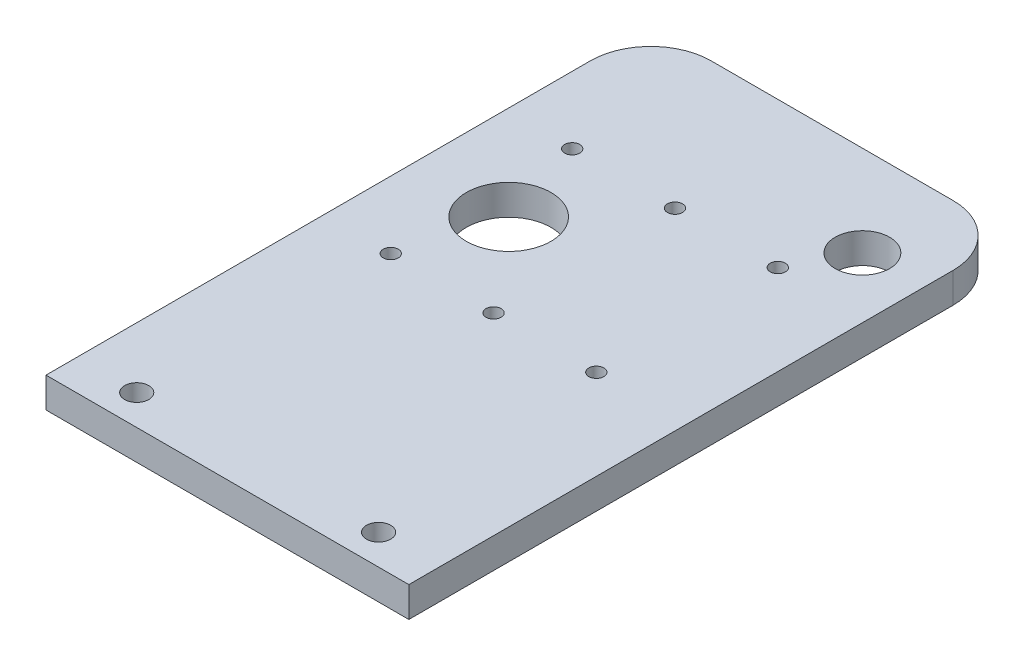
from build123d import *

# Parameters (mm, degrees)
SKETCH_1_R      = 7
SKETCH_1_R_2    = 2
SKETCH_1_R_3    = 4.5
SKETCH_1_R_4    = 1.25
EXTRUDE_1_DEPTH = 5


with BuildPart() as part:
    # 草图1 → 凸台-拉伸1 (new body)
    with BuildSketch(Plane(origin=(0, 0, 0), x_dir=(1, 0, 0), z_dir=(0, 1, 0))):
        with BuildLine():
            Line((-65.328738569, 31.45065883), (-65.328738569, -58.54934117))
            Line((-65.328738569, -58.54934117), (-55.328738569, -58.54934117))
            Line((-55.328738569, -58.54934117), (-15.328738569, -58.54934117))
            Line((-15.328738569, -58.54934117), (-5.328738569, -58.54934117))
            Line((-5.328738569, -58.54934117), (-5.328738569, 2.36065883))
            Line((-5.328738569, 2.36065883), (-5.328738569, 31.45065883))
            ThreePointArc((-5.328738569, 31.45065883), (-8.257670757, 38.521726641), (-15.328738569, 41.45065883))
            Line((-15.328738569, 41.45065883), (-55.328738569, 41.45065883))
            ThreePointArc((-55.328738569, 41.45065883), (-62.399806381, 38.521726641), (-65.328738569, 31.45065883))
        make_face()
        with Locations(Location((-49.728738569, 2.36065883, 0), (0, 0, 270))):
            Circle(SKETCH_1_R, mode=Mode.SUBTRACT)
        with Locations(Location((-55.328738569, -53.54934117, 0), (0, 0, 270))):
            Circle(SKETCH_1_R_2, mode=Mode.SUBTRACT)
        with Locations(Location((-15.328738569, -53.54934117, 0), (0, 0, 270))):
            Circle(SKETCH_1_R_2, mode=Mode.SUBTRACT)
        with Locations(Location((-15.328738569, 26.45065883, 0), (0, 0, 270))):
            Circle(SKETCH_1_R_3, mode=Mode.SUBTRACT)
        with Locations(Location((-54.228738569, 17.36065883, 0), (0, 0, 270))):
            Circle(SKETCH_1_R_4, mode=Mode.SUBTRACT)
        with Locations(Location((-37.228738569, 17.36065883, 0), (0, 0, 270))):
            Circle(SKETCH_1_R_4, mode=Mode.SUBTRACT)
        with Locations(Location((-20.228738569, 17.36065883, 0), (0, 0, 270))):
            Circle(SKETCH_1_R_4, mode=Mode.SUBTRACT)
        with Locations(Location((-54.228738569, -12.63934117, 0), (0, 0, 270))):
            Circle(SKETCH_1_R_4, mode=Mode.SUBTRACT)
        with Locations(Location((-37.228738569, -12.63934117, 0), (0, 0, 270))):
            Circle(SKETCH_1_R_4, mode=Mode.SUBTRACT)
        with Locations(Location((-20.228738569, -12.63934117, 0), (0, 0, 270))):
            Circle(SKETCH_1_R_4, mode=Mode.SUBTRACT)
    extrude(amount=EXTRUDE_1_DEPTH)


solid = part.part
